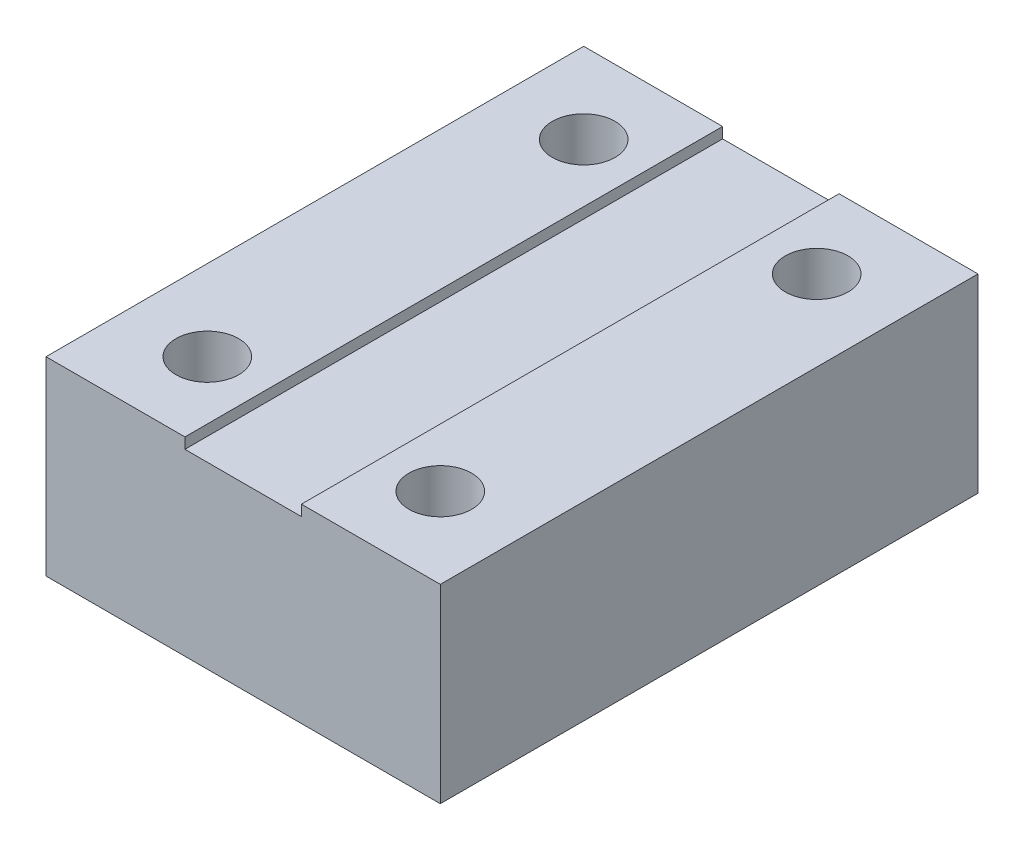
from build123d import *

# Parameters (mm, degrees)
SCHIZZO1_W                   = 22
SCHIZZO1_H                   = 10.6
ESTRUSIONE_ESTRUSIONE1_DEPTH = 15
TAGLIO_ESTRUSIONE3_REACH     = 23.409
SCHIZZO5_R                   = 1.75
SCHIZZO5_3_W                 = 6.5
SCHIZZO5_3_H                 = 30
TAGLIO_ESTRUSIONE4_DEPTH     = 0.6


with BuildPart() as part:
    # Schizzo1 → Estrusione-Estrusione1 (new, symmetric)
    with BuildSketch(Plane.XY):
        Rectangle(SCHIZZO1_W, SCHIZZO1_H)
    extrude(amount=ESTRUSIONE_ESTRUSIONE1_DEPTH, both=True)

    # Schizzo5 → Taglio-Estrusione3 (cut, up to next)
    with BuildSketch(Plane(origin=(0, 5.3, 0), x_dir=(1, 0, 0), z_dir=(0, 1, 0)), mode=Mode.PRIVATE) as taglio_estrusione3_sk1:
        with Locations((6.5, 10.5)):
            Circle(SCHIZZO5_R)
    taglio_estrusione3_tool1 = extrude(taglio_estrusione3_sk1.sketch, amount=-TAGLIO_ESTRUSIONE3_REACH, mode=Mode.PRIVATE) & part.part
    # Schizzo5 → Taglio-Estrusione3 (cut, up to next)
    with BuildSketch(Plane(origin=(0, 5.3, 0), x_dir=(1, 0, 0), z_dir=(0, 1, 0)), mode=Mode.PRIVATE) as taglio_estrusione3_sk2:
        with Locations((6.5, -10.5)):
            Circle(SCHIZZO5_R)
    taglio_estrusione3_tool2 = extrude(taglio_estrusione3_sk2.sketch, amount=-TAGLIO_ESTRUSIONE3_REACH, mode=Mode.PRIVATE) & part.part
    # Schizzo5 → Taglio-Estrusione3 (cut, up to next)
    with BuildSketch(Plane(origin=(0, 5.3, 0), x_dir=(1, 0, 0), z_dir=(0, 1, 0)), mode=Mode.PRIVATE) as taglio_estrusione3_sk3:
        with Locations((-6.5, -10.5)):
            Circle(SCHIZZO5_R)
    taglio_estrusione3_tool3 = extrude(taglio_estrusione3_sk3.sketch, amount=-TAGLIO_ESTRUSIONE3_REACH, mode=Mode.PRIVATE) & part.part
    # Schizzo5 → Taglio-Estrusione3 (cut, up to next)
    with BuildSketch(Plane(origin=(0, 5.3, 0), x_dir=(1, 0, 0), z_dir=(0, 1, 0)), mode=Mode.PRIVATE) as taglio_estrusione3_sk4:
        with Locations((-6.5, 10.5)):
            Circle(SCHIZZO5_R)
    taglio_estrusione3_tool4 = extrude(taglio_estrusione3_sk4.sketch, amount=-TAGLIO_ESTRUSIONE3_REACH, mode=Mode.PRIVATE) & part.part
    add(taglio_estrusione3_tool1.solids().sort_by_distance((6.5, 5.3, -10.5))[0], mode=Mode.SUBTRACT)
    add(taglio_estrusione3_tool2.solids().sort_by_distance((6.5, 5.3, 10.5))[0], mode=Mode.SUBTRACT)
    add(taglio_estrusione3_tool3.solids().sort_by_distance((-6.5, 5.3, 10.5))[0], mode=Mode.SUBTRACT)
    add(taglio_estrusione3_tool4.solids().sort_by_distance((-6.5, 5.3, -10.5))[0], mode=Mode.SUBTRACT)

    # Schizzo5<3> → Taglio-Estrusione4 (cut)
    with BuildSketch(Plane(origin=(0, 5.3, 0), x_dir=(1, 0, 0), z_dir=(0, 1, 0))):
        Rectangle(SCHIZZO5_3_W, SCHIZZO5_3_H)
    extrude(amount=-TAGLIO_ESTRUSIONE4_DEPTH, mode=Mode.SUBTRACT)


solid = part.part
